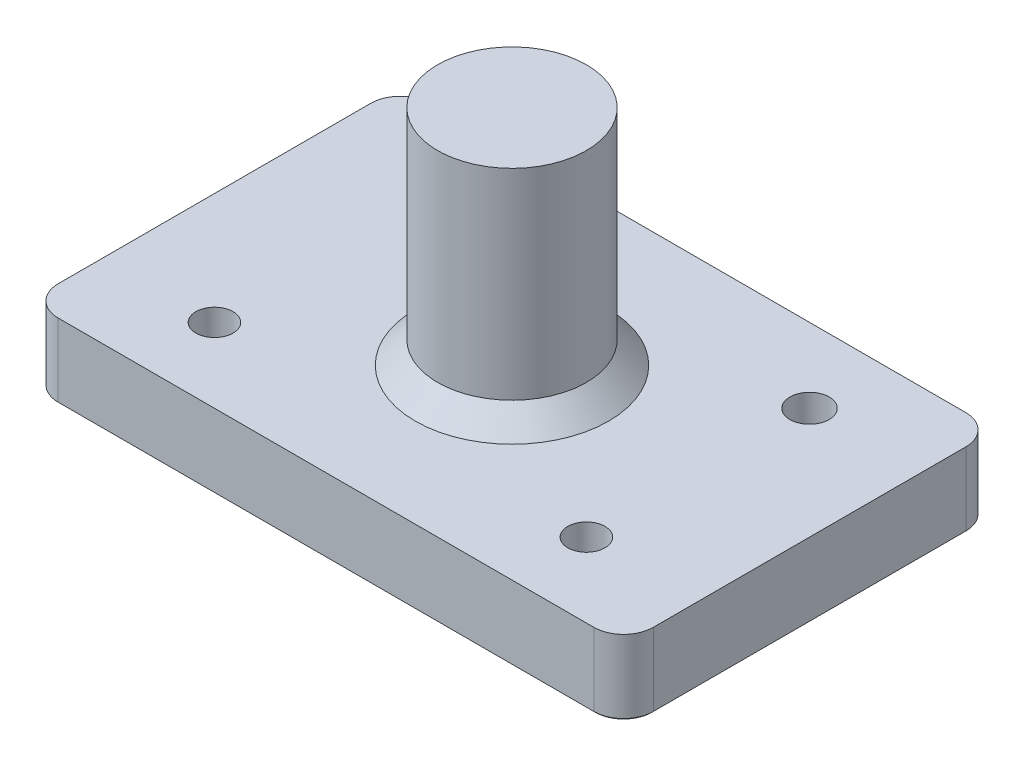
from build123d import *

# Parameters (mm, degrees)
SKETCH1_W           = 101.6
SKETCH1_H           = 63.5
SKETCH1_R           = 3.175
SKETCH1_R_2         = 3.349234597
BOSS_EXTRUDE1_DEPTH = 12.7
SKETCH2_R           = 12.7
BOSS_EXTRUDE2_DEPTH = 38.1
CHAMFER1_SIZE       = 3.81
FILLET1_R           = 5.08
CHAMFER2_SIZE       = 0.254


with BuildPart() as part:
    # Sketch1 → Boss-Extrude1 (new body)
    with BuildSketch(Plane(origin=(0, 0, 0), x_dir=(1, 0, 0), z_dir=(0, 1, 0))):
        Rectangle(SKETCH1_W, SKETCH1_H)
        with Locations(Location((-31.75, 19.05, 0), (0, 0, 270))):
            Circle(SKETCH1_R, mode=Mode.SUBTRACT)
        with Locations(Location((-31.75, -19.05, 0), (0, 0, 270))):
            Circle(SKETCH1_R, mode=Mode.SUBTRACT)
        with Locations(Location((31.75, -19.05, 0), (0, 0, 270))):
            Circle(SKETCH1_R, mode=Mode.SUBTRACT)
        with Locations(Location((31.75, 19.05, 0), (0, 0, 270))):
            Circle(SKETCH1_R_2, mode=Mode.SUBTRACT)
    extrude(amount=BOSS_EXTRUDE1_DEPTH)

    # Sketch2 → Boss-Extrude2 (add)
    with BuildSketch(Plane(origin=(0, 12.7, 0), x_dir=(1, 0, 0), z_dir=(0, 1, 0))):
        with Locations(Location((0, 0, 0), (0, 0, 90))):
            Circle(SKETCH2_R)
    extrude(amount=BOSS_EXTRUDE2_DEPTH)

    # Chamfer1
    chamfer1_edges = [part.edges().sort_by_distance(p)[0] for p in [
        (0, 12.7, 12.7),
    ]]
    chamfer(chamfer1_edges, length=CHAMFER1_SIZE)

    # Fillet1
    fillet1_edges = [part.edges().sort_by_distance(p)[0] for p in [
        (50.8, 6.35, 31.75),
        (-50.8, 6.35, 31.75),
        (-50.8, 6.35, -31.75),
        (50.8, 6.35, -31.75),
    ]]
    fillet(fillet1_edges, radius=FILLET1_R)

    # Chamfer2
    chamfer2_edges = [part.edges().sort_by_distance(p)[0] for p in [
        (-31.75, 0, 15.875),
        (-31.75, 0, -22.225),
        (31.75, 0, 15.875),
        (31.75, 0, -22.399234597),
        (0, 0, 31.75),
        (50.8, 0, 0),
        (-50.8, 0, 0),
        (0, 0, -31.75),
        (-49.312102448, 0, -30.262102448),
        (49.312102448, 0, -30.262102448),
        (49.312102448, 0, 30.262102448),
        (-49.312102448, 0, 30.262102448),
    ]]
    chamfer(chamfer2_edges, length=CHAMFER2_SIZE)


solid = part.part
